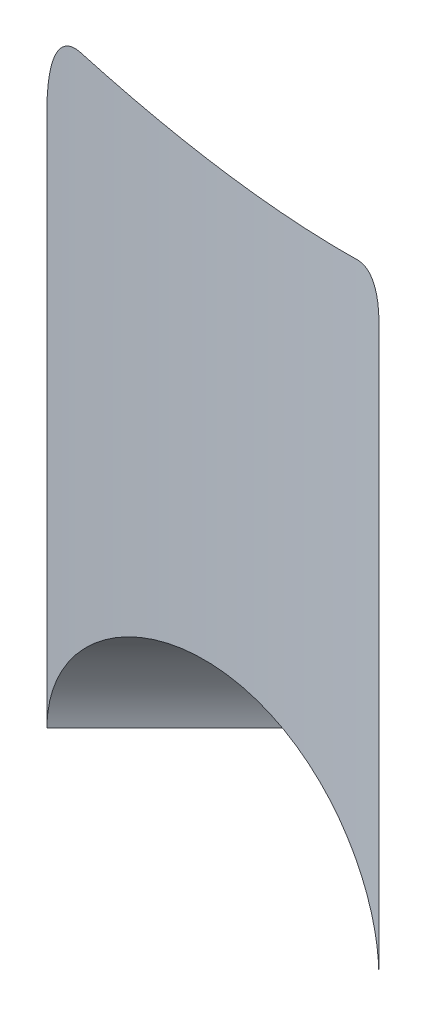
from build123d import *

# Parameters (mm, degrees)
BOSS_EXTRUDE1_DEPTH = 25.4
CUT_EXTRUDE3_REACH  = 30.398
SKETCH2_R           = 6.35
SKETCH5_R           = 83.82
CUT_EXTRUDE4_DEPTH  = 29.398063314
CUT_EXTRUDE5_REACH  = 30.361
SKETCH6_W           = 15.992982812
SKETCH6_H           = 22.96614998
FILLET1_R           = 2.54


with BuildPart() as part:
    # Sketch1 → Boss-Extrude1 (new body)
    with BuildSketch(Plane(origin=(0, 0, 0), x_dir=(1, 0, 0), z_dir=(0, 1, 0))):
        Polygon((0, 0), (-8.980256121, -8.980256121), (8.980256121, -8.980256121), align=None)
    extrude(amount=BOSS_EXTRUDE1_DEPTH)

    # Sketch2 → Cut-Extrude3 (cut, up to next)
    with BuildSketch(Plane(origin=(0, 0, 0), x_dir=(-0.7071067811865479, 0, -0.7071067811865472), z_dir=(0.7071067811865472, 0, -0.7071067811865479)), mode=Mode.PRIVATE) as cut_extrude3_sk1:
        with Locations((-6.35, 0)):
            Circle(SKETCH2_R)
    cut_extrude3_tool1 = extrude(cut_extrude3_sk1.sketch, amount=-CUT_EXTRUDE3_REACH, mode=Mode.PRIVATE) & part.part
    add(cut_extrude3_tool1.solids().sort_by_distance((4.490128, 0, 4.490128))[0], mode=Mode.SUBTRACT)

    # Sketch5 → Cut-Extrude4 (cut, through all)
    with BuildSketch(Plane(origin=(0, 25.4, 0), x_dir=(1, 0, 0), z_dir=(0, 1, 0))):
        with Locations((-9.838175311, -90.660480401)):
            Circle(SKETCH5_R)
    extrude(amount=-CUT_EXTRUDE4_DEPTH, mode=Mode.SUBTRACT)

    # Sketch6 → Cut-Extrude5 (cut, up to next)
    with BuildSketch(Plane(origin=(0.17794868, 0.498418532, -1.352732428), x_dir=(0.9924678045108147, -0.04235414104403209, 0.11495122333366274), z_dir=(-0.12250574276124108, -0.34312776222937363, 0.9312656343804271)), mode=Mode.PRIVATE) as cut_extrude5_sk1:
        with Locations((0.872619915, 15.455352815)):
            Rectangle(SKETCH6_W, SKETCH6_H)
    cut_extrude5_tool1 = extrude(cut_extrude5_sk1.sketch, amount=-CUT_EXTRUDE5_REACH, mode=Mode.PRIVATE) & part.part
    add(cut_extrude5_tool1.solids().sort_by_distance((1.043996, 14.963732, 4.090985))[0], mode=Mode.SUBTRACT)

    # Fillet1
    fillet1_edges = [part.edges().sort_by_distance(p)[0] for p in [
        (-3.446132209, 14.816666667, 3.446132209),
        (4.490128061, 14.816666667, 4.490128061),
    ]]
    fillet(fillet1_edges, radius=FILLET1_R)


solid = part.part
